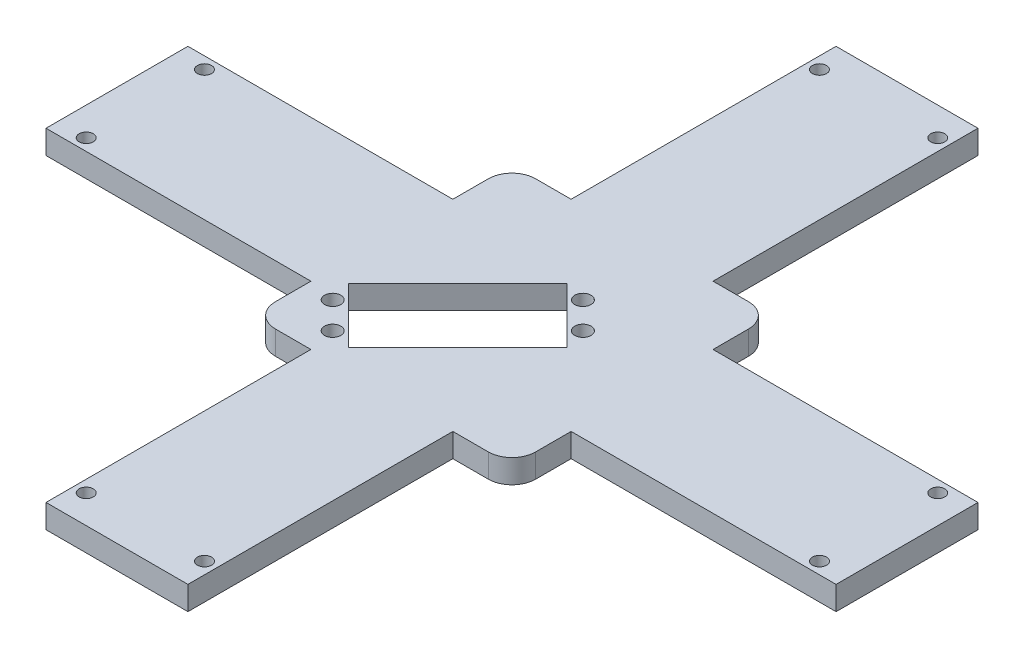
from build123d import *

# Parameters (mm, degrees)
BOSS_EXTRU_1_DEPTH           = 6.35
ENL_V_MAT_EXTRU_1_REACH      = 152.112
ESQUISSE2_R                  = 2.1844
ENL_V_MAT_EXTRU_2_DEPTH      = 2.54
ENL_V_MAT_EXTRU_3_REACH      = 152.112
ESQUISSE5_R                  = 1.89865
ENL_V_MAT_EXTRU_4_DEPTH      = 151.112071772
R_P_TITION_CIRCULAIRE1_COUNT = 4


with BuildPart() as part:
    # Esquisse1 → Boss.-Extru.1 (new body)
    with BuildSketch(Plane(origin=(0, 0, 0), x_dir=(1, 0, 0), z_dir=(0, 1, 0))):
        with BuildLine():
            Line((19.049999994, 106.045), (-19.050000006, 106.045))
            Line((-19.050000006, 106.045), (-19.050000006, 34.925))
            Line((-19.050000006, 34.925), (-28.575, 34.925))
            ThreePointArc((-28.575, 34.925), (-33.065128061, 33.065128061), (-34.925, 28.575))
            Line((-34.925, 28.575), (-34.925, 19.05))
            Line((-34.925, 19.05), (-106.045, 19.05))
            Line((-106.045, 19.05), (-106.045, -19.05))
            Line((-106.045, -19.05), (-34.925, -19.05))
            Line((-34.925, -19.05), (-34.925, -28.575))
            ThreePointArc((-34.925, -28.575), (-33.065128061, -33.065128061), (-28.575, -34.925))
            Line((-28.575, -34.925), (-19.05, -34.925))
            Line((-19.05, -34.925), (-19.05, -106.045))
            Line((-19.05, -106.045), (19.05, -106.045))
            Line((19.05, -106.045), (19.05, -34.925))
            Line((19.05, -34.925), (28.575, -34.925))
            ThreePointArc((28.575, -34.925), (33.065128061, -33.065128061), (34.925, -28.575))
            Line((34.925, -28.575), (34.925, -19.05))
            Line((34.925, -19.05), (106.055502293, -19.05))
            Line((106.055502293, -19.05), (106.055502293, 19.05))
            Line((106.055502293, 19.05), (34.925, 19.05))
            Line((34.925, 19.05), (34.925, 28.575))
            ThreePointArc((34.925, 28.575), (33.065128061, 33.065128061), (28.575, 34.925))
            Line((28.575, 34.925), (19.049999994, 34.925))
            Line((19.049999994, 34.925), (19.049999994, 106.045))
        make_face()
    extrude(amount=BOSS_EXTRU_1_DEPTH)

    # Esquisse2 → Enlèv. mat.-Extru.1 (cut, up to next)
    with BuildSketch(Plane.XZ, mode=Mode.PRIVATE) as enl_v_mat_extru_1_sk1:
        with Locations(Location((-20.474983956, 27.659188853, 0), (0, 0, 270))):
            Circle(ESQUISSE2_R)
    enl_v_mat_extru_1_tool1 = extrude(enl_v_mat_extru_1_sk1.sketch, amount=-ENL_V_MAT_EXTRU_1_REACH, mode=Mode.PRIVATE) & part.part
    # Esquisse2 → Enlèv. mat.-Extru.1 (cut, up to next)
    with BuildSketch(Plane.XZ, mode=Mode.PRIVATE) as enl_v_mat_extru_1_sk2:
        with Locations(Location((-27.659188853, 20.474983956, 0), (0, 0, 270))):
            Circle(ESQUISSE2_R)
    enl_v_mat_extru_1_tool2 = extrude(enl_v_mat_extru_1_sk2.sketch, amount=-ENL_V_MAT_EXTRU_1_REACH, mode=Mode.PRIVATE) & part.part
    # Esquisse2 → Enlèv. mat.-Extru.1 (cut, up to next)
    with BuildSketch(Plane.XZ, mode=Mode.PRIVATE) as enl_v_mat_extru_1_sk3:
        with Locations(Location((13.111173937, -5.92696904, 0), (0, 0, 270))):
            Circle(ESQUISSE2_R)
    enl_v_mat_extru_1_tool3 = extrude(enl_v_mat_extru_1_sk3.sketch, amount=-ENL_V_MAT_EXTRU_1_REACH, mode=Mode.PRIVATE) & part.part
    # Esquisse2 → Enlèv. mat.-Extru.1 (cut, up to next)
    with BuildSketch(Plane.XZ, mode=Mode.PRIVATE) as enl_v_mat_extru_1_sk4:
        with Locations(Location((5.92696904, -13.111173937, 0), (0, 0, 270))):
            Circle(ESQUISSE2_R)
    enl_v_mat_extru_1_tool4 = extrude(enl_v_mat_extru_1_sk4.sketch, amount=-ENL_V_MAT_EXTRU_1_REACH, mode=Mode.PRIVATE) & part.part
    add(enl_v_mat_extru_1_tool1.solids().sort_by_distance((-20.474984, 0, 27.659189))[0], mode=Mode.SUBTRACT)
    add(enl_v_mat_extru_1_tool2.solids().sort_by_distance((-27.659189, 0, 20.474984))[0], mode=Mode.SUBTRACT)
    add(enl_v_mat_extru_1_tool3.solids().sort_by_distance((13.111174, 0, -5.926969))[0], mode=Mode.SUBTRACT)
    add(enl_v_mat_extru_1_tool4.solids().sort_by_distance((5.926969, 0, -13.111174))[0], mode=Mode.SUBTRACT)

    # Esquisse3 → Enlèv. mat.-Extru.2 (cut)
    with BuildSketch(Plane.XZ):
        Polygon((16.652426289, -6.875844748), (15.703550581, -3.334592395), (12.162298229, -2.385716687), (9.569921584, -4.978093332), (10.518797292, -8.519345684), (14.060049645, -9.468221392), align=None)
        Polygon((9.468221392, -14.060049645), (8.519345684, -10.518797292), (4.978093332, -9.569921584), (2.385716687, -12.162298229), (3.334592395, -15.703550581), (6.875844748, -16.652426289), align=None)
        Polygon((-17.882607312, 30.251565497), (-21.423859664, 31.200441205), (-24.016236309, 28.608064561), (-23.0673606, 25.066812208), (-19.526108248, 24.1179365), (-16.933731604, 26.710313145), align=None)
        Polygon((-28.608064561, 24.016236309), (-31.200441205, 21.423859664), (-30.251565497, 17.882607312), (-26.710313145, 16.933731604), (-24.1179365, 19.526108248), (-25.066812208, 23.0673606), align=None)
    extrude(amount=-ENL_V_MAT_EXTRU_2_DEPTH, mode=Mode.SUBTRACT)

    # Esquisse4 → Enlèv. mat.-Extru.3 (cut, up to next)
    with BuildSketch(Plane.XZ, mode=Mode.PRIVATE) as enl_v_mat_extru_3_sk1:
        Polygon((-29.419319053, 14.512093892), (-14.512093892, 29.419319053), (14.8174226, 0.089802561), (-0.089802561, -14.8174226), align=None)
    enl_v_mat_extru_3_tool1 = extrude(enl_v_mat_extru_3_sk1.sketch, amount=-ENL_V_MAT_EXTRU_3_REACH, mode=Mode.PRIVATE) & part.part
    add(enl_v_mat_extru_3_tool1.solids().sort_by_distance((-7.300948, 0, 7.300948))[0], mode=Mode.SUBTRACT)

    # Esquisse5 → Enlèv. mat.-Extru.4 (cut, through all)
    with BuildSketch(Plane(origin=(0, 6.35, 0), x_dir=(1, 0, 0), z_dir=(0, 1, 0))):
        with Locations(Location((15.875, -98.425, 0), (0, 0, 270))):
            Circle(ESQUISSE5_R)
        with Locations(Location((-15.875, -98.425, 0), (0, 0, 270))):
            Circle(ESQUISSE5_R)
    enl_v_mat_extru_4 = extrude(amount=-ENL_V_MAT_EXTRU_4_DEPTH, mode=Mode.SUBTRACT)

    # Répétition circulaire1: Enlèv. mat.-Extru.4 ×4 about axis
    r_p_tition_circulaire1_axis = Axis((0, 0, 0), (0, 1, 0))
    for i in range(1, R_P_TITION_CIRCULAIRE1_COUNT):
        add(enl_v_mat_extru_4.rotate(r_p_tition_circulaire1_axis, i * 360 / R_P_TITION_CIRCULAIRE1_COUNT), mode=Mode.SUBTRACT)


solid = part.part
